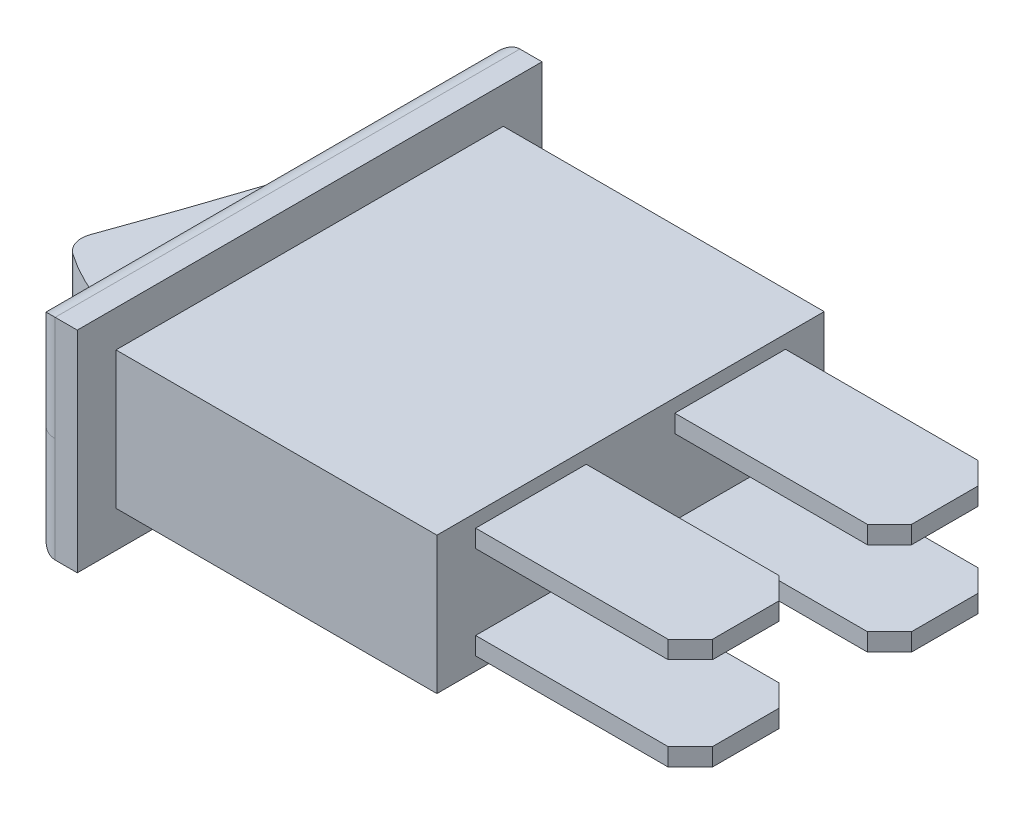
from build123d import *

# Parameters (mm, degrees)
BOSS_EXTRU_1_DEPTH           = 3.1
ESQUISSE2_W                  = 2
ESQUISSE2_H                  = 21
BOSS_EXTRU_2_DEPTH           = 1.65
ESQUISSE3_W                  = 5
ESQUISSE3_H                  = 0.8
BOSS_EXTRU_3_DEPTH           = 9.7
CHANFREIN1_SIZE              = 1
CONG_1_R                     = 1
CHANFREIN1_OF_SYM_TRIE1_SIZE = 1
CONG_1_OF_SYM_TRIE1_R        = 1


with BuildPart() as part:
    # Esquisse1 → Boss.-Extru.1 (new body)
    with BuildSketch(Plane(origin=(0, 0, 0), x_dir=(1, 0, 0), z_dir=(0, 1, 0))):
        with BuildLine():
            Line((0, 0), (0, 1.75))
            Line((0, 1.75), (-2, 1.75))
            Line((-2, 1.75), (-2, -4.33188101))
            ThreePointArc((-2, -4.33188101), (-3.484320415, -8.968776107), (-5.089343046, -13.565286261))
            ThreePointArc((-5.089343046, -13.565286261), (-5.102407263, -14.21094477), (-4.718121663, -14.729953597))
            ThreePointArc((-4.718121663, -14.729953597), (-3.408583651, -15.498315478), (-2, -16.065026941))
            Line((-2, -16.065026941), (-2, -19.25))
            Line((-2, -19.25), (0, -19.25))
            Line((0, -19.25), (0, -17.5))
            Line((0, -17.5), (14.5, -17.5))
            Line((14.5, -17.5), (14.5, 0))
            Line((14.5, 0), (0, 0))
        make_face()
    boss_extru_1 = extrude(amount=BOSS_EXTRU_1_DEPTH)

    # Esquisse2 → Boss.-Extru.2 (add)
    with BuildSketch(Plane(origin=(0, 3.1, 0), x_dir=(1, 0, 0), z_dir=(0, 1, 0))):
        with Locations((-1, -8.75)):
            Rectangle(ESQUISSE2_W, ESQUISSE2_H)
    boss_extru_2 = extrude(amount=BOSS_EXTRU_2_DEPTH)

    # Esquisse3 → Boss.-Extru.3 (add)
    with BuildSketch(Plane(origin=(14.5, 0, 0), x_dir=(0, 0, -1), z_dir=(1, 0, 0))):
        with Locations((-13.25, 2.1)):
            Rectangle(ESQUISSE3_W, ESQUISSE3_H)
        with Locations((-4.25, 2.1)):
            Rectangle(ESQUISSE3_W, ESQUISSE3_H)
    boss_extru_3 = extrude(amount=BOSS_EXTRU_3_DEPTH)

    # Chanfrein1
    chanfrein1_edges = [part.edges().sort_by_distance(p)[0] for p in [
        (24.2, 2.1, 15.75),
        (24.2, 2.1, 10.75),
        (24.2, 2.1, 6.75),
        (24.2, 2.1, 1.75),
    ]]
    chamfer(chanfrein1_edges, length=CHANFREIN1_SIZE)

    # Congé1
    cong_1_edges = [part.edges().sort_by_distance(p)[0] for p in [
        (-2, 2.375, 19.25),
        (-2, 2.375, -1.75),
        (-2, 4.75, 8.75),
    ]]
    fillet(cong_1_edges, radius=CONG_1_R)

    # Symétrie1: Boss.-Extru.1, Boss.-Extru.2, Boss.-Extru.3 across plane
    add(boss_extru_1.mirror(Plane(origin=(1.115166408, 0, 6.288257404), x_dir=(0, 0, 1), z_dir=(0, 1, 0))))
    add(boss_extru_2.mirror(Plane(origin=(1.115166408, 0, 6.288257404), x_dir=(0, 0, 1), z_dir=(0, 1, 0))))
    add(boss_extru_3.mirror(Plane(origin=(1.115166408, 0, 6.288257404), x_dir=(0, 0, 1), z_dir=(0, 1, 0))))

    # Chanfrein1 of Symétrie1
    chanfrein1_of_sym_trie1_edges = [part.edges().sort_by_distance(p)[0] for p in [
        (24.2, -2.1, 15.75),
        (24.2, -2.1, 10.75),
        (24.2, -2.1, 6.75),
        (24.2, -2.1, 1.75),
    ]]
    chamfer(chanfrein1_of_sym_trie1_edges, length=CHANFREIN1_OF_SYM_TRIE1_SIZE)

    # Congé1 of Symétrie1
    cong_1_of_sym_trie1_edges = [part.edges().sort_by_distance(p)[0] for p in [
        (-2, -2.375, 19.25),
        (-2, -2.375, -1.75),
        (-2, -4.75, 8.75),
    ]]
    fillet(cong_1_of_sym_trie1_edges, radius=CONG_1_OF_SYM_TRIE1_R)


solid = part.part
